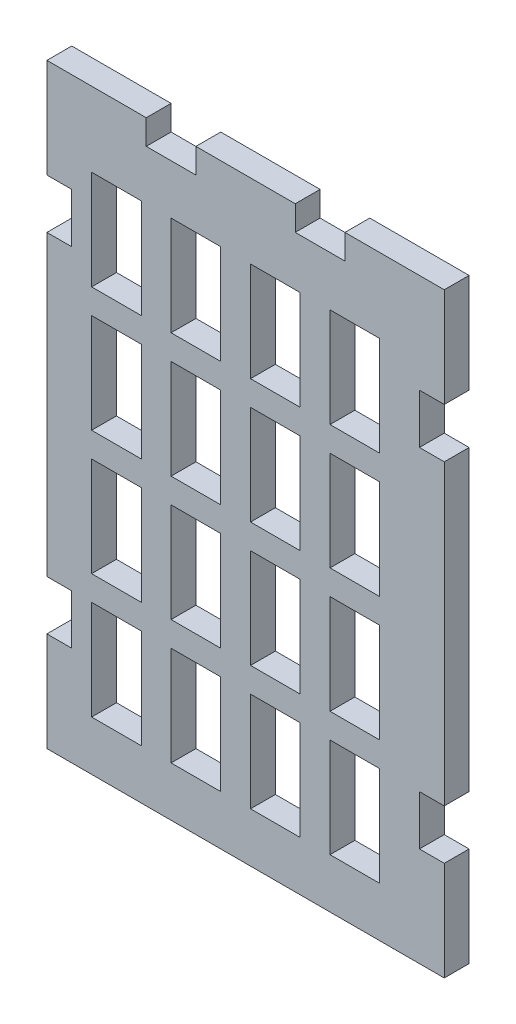
from build123d import *

# Parameters (mm, degrees)
BOSS_EXTRUDE1_DEPTH  = 3.175
SKETCH2_W            = 6.35
SKETCH2_H            = 12.7
CUT_EXTRUDE1_DEPTH   = 5.08
LPATTERN1_COUNT      = 4
LPATTERN1_PITCH      = 10.16
LPATTERN1_COUNT_DIR2 = 4
LPATTERN1_PITCH_DIR2 = 15.875


with BuildPart() as part:
    # Sketch1 → Boss-Extrude1 (new body)
    with BuildSketch(Plane.XY):
        Polygon((0, -76.2), (12.7, -76.2), (38.1, -76.2), (50.8, -76.2), (50.8, -63.5), (47.625, -63.5), (47.625, -57.15), (50.8, -57.15), (50.8, -19.05), (47.625, -19.05), (47.625, -12.7), (50.8, -12.7), (50.8, 0), (38.1, 0), (38.1, -3.175), (31.75, -3.175), (31.75, 0), (19.05, 0), (19.05, -3.175), (12.7, -3.175), (12.7, 0), (0, 0), (0, -12.7), (3.175, -12.7), (3.175, -19.05), (0, -19.05), (0, -57.15), (3.175, -57.15), (3.175, -63.5), (0, -63.5), align=None)
    extrude(amount=BOSS_EXTRUDE1_DEPTH)

    # Sketch2 → Cut-Extrude1 (cut)
    with BuildSketch(Plane.XY.offset(3.175)):
        with Locations((8.89, -15.875)):
            Rectangle(SKETCH2_W, SKETCH2_H)
    cut_extrude1 = extrude(amount=-CUT_EXTRUDE1_DEPTH, mode=Mode.SUBTRACT)

    # LPattern1: Cut-Extrude1 4 × 4
    with Locations(*[(i * LPATTERN1_PITCH, -j * LPATTERN1_PITCH_DIR2, 0) for i in range(LPATTERN1_COUNT) for j in range(LPATTERN1_COUNT_DIR2) if (i, j) != (0, 0)]):
        add(cut_extrude1, mode=Mode.SUBTRACT)


solid = part.part
